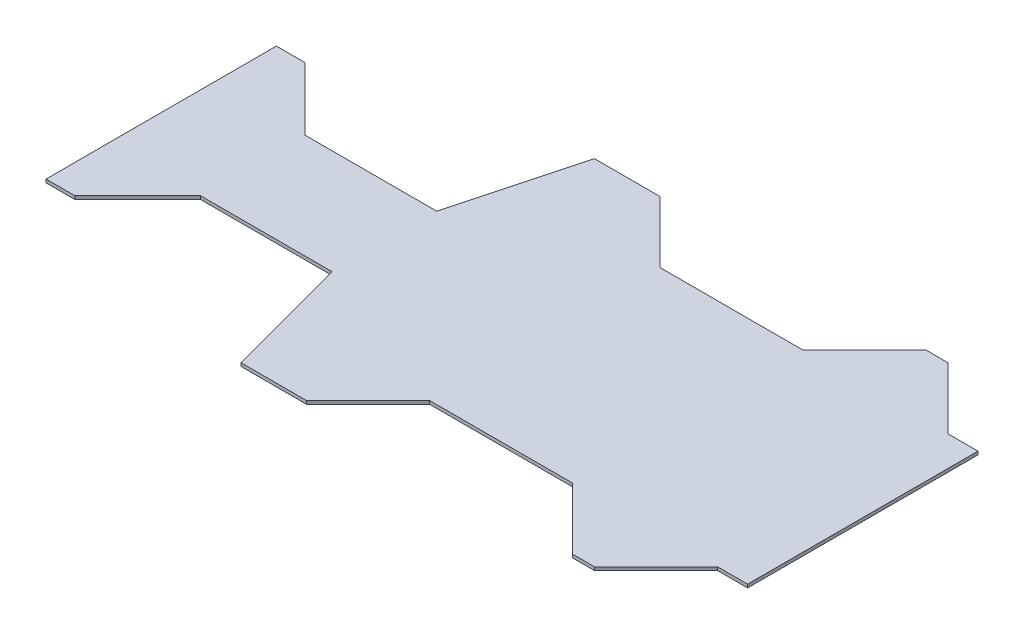
from build123d import *

# Parameters (mm, degrees)
PLATE_DEPTH = 1.5875


with BuildPart() as part:
    # Sketch1 → Plate (new body)
    with BuildSketch(Plane(origin=(0, 0, 0), x_dir=(1, 0, 0), z_dir=(0, 1, 0))):
        Polygon((125.73, -85.725), (115.177364882, -85.725), (85.332364882, -55.88), (15.875, -55.88), (-13.97, -85.725), (-45.72, -85.725), (-61.884035033, -25.4), (-125.73, -25.4), (-156.21, -55.88), (-170.18, -55.88), (-170.18, 55.88), (-156.21, 55.88), (-125.73, 25.4), (-61.884035033, 25.4), (-45.72, 85.725), (-13.97, 85.725), (15.875, 55.88), (85.332364882, 55.88), (115.177364882, 85.725), (125.73, 85.725), (155.575, 55.88), (170.18, 55.88), (170.18, -55.88), (155.575, -55.88), align=None)
    extrude(amount=PLATE_DEPTH)


solid = part.part
